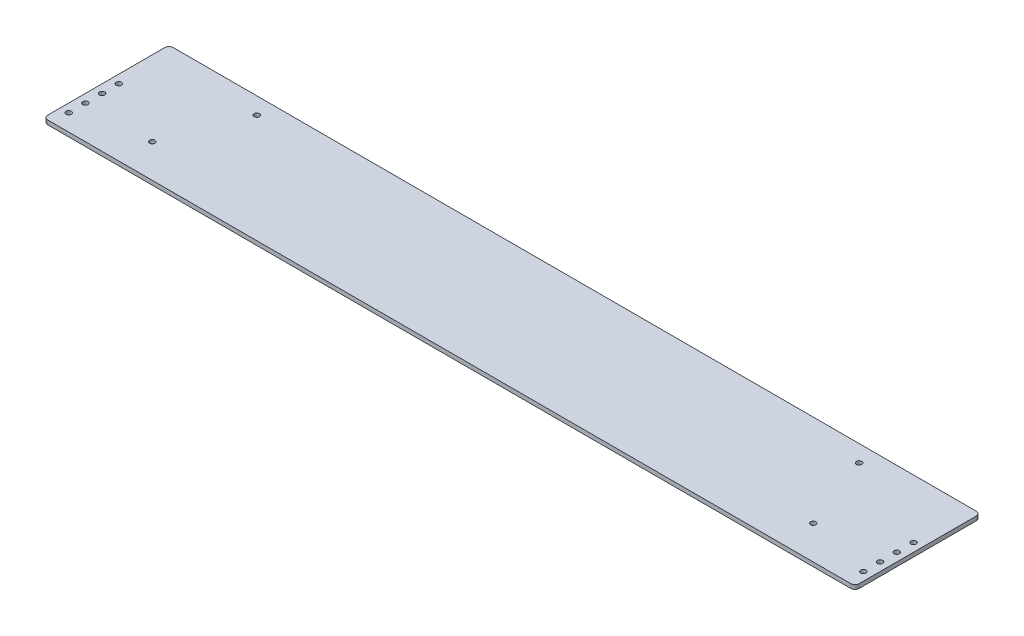
from build123d import *

# Parameters (mm, degrees)
SKETCH1_W           = 615.95
SKETCH1_H           = 95.25
SKETCH1_R           = 2.0193
BOSS_EXTRUDE1_DEPTH = 3.175
FILLET1_R           = 3.175
SKETCH2_R           = 2.0193
CUT_EXTRUDE1_DEPTH  = 312.651763793


with BuildPart() as part:
    # Sketch1 → Boss-Extrude1 (new body)
    with BuildSketch(Plane(origin=(0, 0, 0), x_dir=(1, 0, 0), z_dir=(0, 1, 0))):
        Rectangle(SKETCH1_W, SKETCH1_H)
        with Locations(Location((-301.625, 3.175, 0), (0, 0, 270))):
            Circle(SKETCH1_R, mode=Mode.SUBTRACT)
        with Locations(Location((-301.625, -9.525, 0), (0, 0, 270))):
            Circle(SKETCH1_R, mode=Mode.SUBTRACT)
        with Locations(Location((-301.625, -22.225, 0), (0, 0, 270))):
            Circle(SKETCH1_R, mode=Mode.SUBTRACT)
        with Locations(Location((-301.625, -34.925, 0), (0, 0, 270))):
            Circle(SKETCH1_R, mode=Mode.SUBTRACT)
        with Locations(Location((301.625, -34.925, 0), (0, 0, 90))):
            Circle(SKETCH1_R, mode=Mode.SUBTRACT)
        with Locations(Location((301.625, -22.225, 0), (0, 0, 90))):
            Circle(SKETCH1_R, mode=Mode.SUBTRACT)
        with Locations(Location((301.625, -9.525, 0), (0, 0, 90))):
            Circle(SKETCH1_R, mode=Mode.SUBTRACT)
        with Locations(Location((301.625, 3.175, 0), (0, 0, 90))):
            Circle(SKETCH1_R, mode=Mode.SUBTRACT)
    extrude(amount=BOSS_EXTRUDE1_DEPTH)

    # Fillet1
    fillet1_edges = [part.edges().sort_by_distance(p)[0] for p in [
        (307.975, 1.5875, 47.625),
        (-307.975, 1.5875, 47.625),
        (-307.975, 1.5875, -47.625),
        (307.975, 1.5875, -47.625),
    ]]
    fillet(fillet1_edges, radius=FILLET1_R)

    # Sketch2 → Cut-Extrude1 (cut, through all)
    with BuildSketch(Plane(origin=(0, 3.175, 0), x_dir=(1, 0, 0), z_dir=(0, 1, 0))):
        with Locations(Location((-228.6, 34.925, 0), (0, 0, 270))):
            Circle(SKETCH2_R)
        with Locations(Location((-250.825, -22.225, 0), (0, 0, 270))):
            Circle(SKETCH2_R)
        with Locations(Location((250.825, -22.225, 0), (0, 0, 90))):
            Circle(SKETCH2_R)
        with Locations(Location((228.6, 34.925, 0), (0, 0, 90))):
            Circle(SKETCH2_R)
    extrude(amount=-CUT_EXTRUDE1_DEPTH, mode=Mode.SUBTRACT)


solid = part.part
